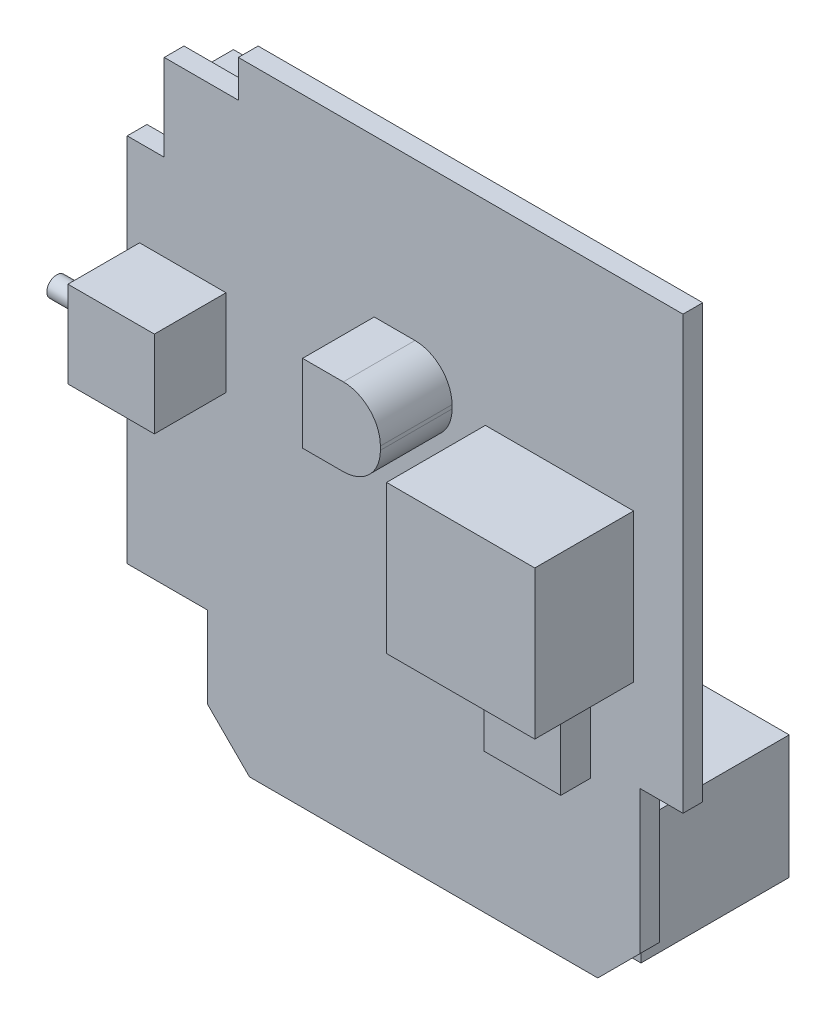
from build123d import *

# Parameters (mm, degrees)
EXTRUDE1_DEPTH  = 1.6
SKETCH3_W       = 6
SKETCH3_H       = 2
EXTRUDE3_DEPTH  = 2.5
SKETCH4_W       = 10
SKETCH4_H       = 10
EXTRUDE4_DEPTH  = 12
SKETCH6_W       = 7
SKETCH6_H       = 7
EXTRUDE5_DEPTH  = 5.8
SKETCH8_R       = 0.8
EXTRUDE7_DEPTH  = 3.81
SKETCH9_W       = 6.3
SKETCH9_H       = 6.3
EXTRUDE8_DEPTH  = 5.8
FILLET1_R       = 3
SKETCH10_W      = 12
SKETCH10_H      = 12
EXTRUDE9_DEPTH  = 8
SKETCH11_W      = 6.2
SKETCH11_H      = 6.7
EXTRUDE10_DEPTH = 2.4


with BuildPart() as part:
    # Sketch1 → Extrude1 (new body)
    with BuildSketch(Plane.XY):
        Polygon((41.5, 3.4), (38.1, 0), (9.9, 0), (6.5, 3.4), (6.5, 10), (0, 10), (0, 40), (3, 40), (3, 47), (9, 47), (9, 50), (45, 50), (45, 15), (41.5, 15), align=None)
    extrude(amount=EXTRUDE1_DEPTH)

    # Sketch3 → Extrude3 (add)
    with BuildSketch(Plane(origin=(0, 0, 0), x_dir=(-1, 0, 0), z_dir=(0, 0, -1))):
        with Locations((-7.5, 45.25)):
            Rectangle(SKETCH3_W, SKETCH3_H)
        with Locations((-7.5, 15.75)):
            Rectangle(SKETCH3_W, SKETCH3_H)
    extrude(amount=EXTRUDE3_DEPTH)

    # Sketch4 → Extrude4 (add)
    with BuildSketch(Plane(origin=(0, 0, 0), x_dir=(-1, 0, 0), z_dir=(0, 0, -1))):
        with Locations((-35, 6.2)):
            Rectangle(SKETCH4_W, SKETCH4_H)
        with Locations((-24, 6.2)):
            Rectangle(SKETCH4_W, SKETCH4_H)
        with Locations((-13, 6.2)):
            Rectangle(SKETCH4_W, SKETCH4_H)
    extrude(amount=EXTRUDE4_DEPTH)

    # Sketch6 → Extrude5 (add)
    with BuildSketch(Plane.XY.offset(1.6)):
        with Locations((4.5, 29.5)):
            Rectangle(SKETCH6_W, SKETCH6_H)
    extrude(amount=EXTRUDE5_DEPTH)

    # Sketch8 → Extrude7 (add)
    with BuildSketch(Plane(origin=(1, 0, 4), x_dir=(0, 0, -1), z_dir=(1, 0, 0))):
        with Locations(Location((-0.5, 29.5, 0), (0, 0, 90))):
            Circle(SKETCH8_R)
    extrude(amount=-EXTRUDE7_DEPTH)

    # Sketch9 → Extrude8 (add)
    with BuildSketch(Plane.XY.offset(1.6)):
        with Locations((23.15, 34.15)):
            Rectangle(SKETCH9_W, SKETCH9_H)
    extrude(amount=EXTRUDE8_DEPTH)

    # Fillet1
    fillet1_edges = [part.edges().sort_by_distance(p)[0] for p in [
        (26.3, 31, 4.5),
        (26.3, 37.3, 4.5),
    ]]
    fillet(fillet1_edges, radius=FILLET1_R)

    # Sketch10 → Extrude9 (add)
    with BuildSketch(Plane.XY.offset(1.6)):
        with Locations((35, 28.2)):
            Rectangle(SKETCH10_W, SKETCH10_H)
    extrude(amount=EXTRUDE9_DEPTH)

    # Sketch11 → Extrude10 (add)
    with BuildSketch(Plane.XY.offset(1.6)):
        with Locations((34.4, 17.05)):
            Rectangle(SKETCH11_W, SKETCH11_H)
    extrude(amount=EXTRUDE10_DEPTH)


solid = part.part
